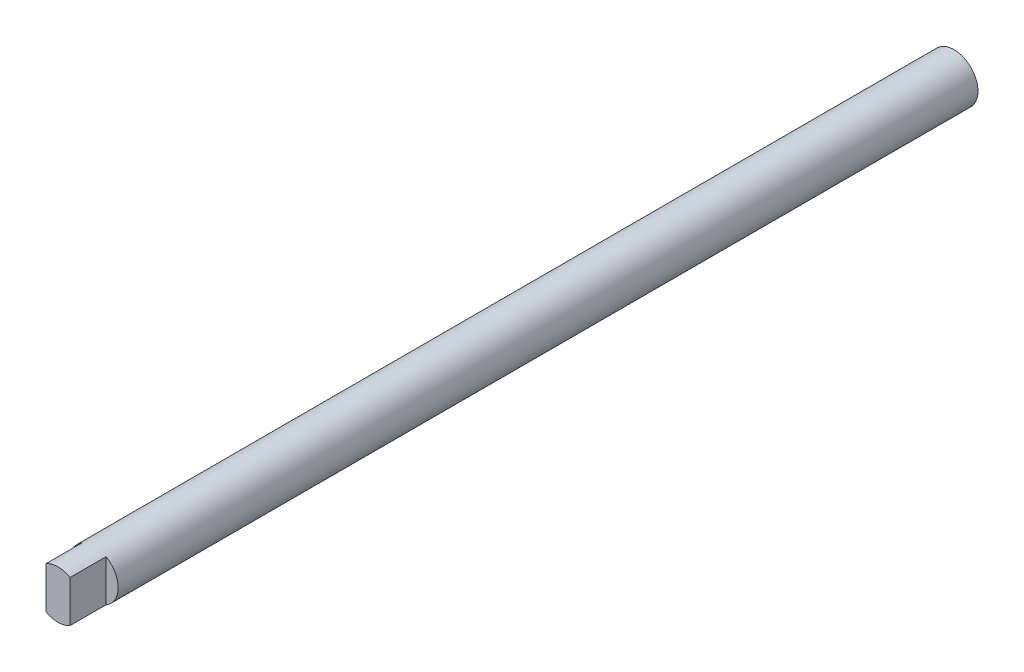
from build123d import *

# Parameters (mm, degrees)
SKETCH_1_R               = 4
EXTRUDE_1_DEPTH          = 74.5
CUT_EXTRUDE_1_DEPTH      = 75.714456432
CUT_EXTRUDE_1_DEPTH_BACK = 75.714456432
SKETCH_2_W               = 2
SKETCH_2_H               = 6


with BuildPart() as part:
    # 草图1 → 凸台-拉伸1 (new, symmetric)
    with BuildSketch(Plane.XY):
        Circle(SKETCH_1_R)
    extrude(amount=EXTRUDE_1_DEPTH, both=True)

    # 草图2 → 切除-拉伸1 (cut, two sides: drawn at the far end of the back side and taken through both)
    with BuildSketch(Plane(origin=(0, 0, 0), x_dir=(1, 0, 0), z_dir=(0, 1, 0)).offset(-CUT_EXTRUDE_1_DEPTH_BACK)):
        with Locations((-3, -71.5)):
            Rectangle(SKETCH_2_W, SKETCH_2_H)
        with Locations((3, -71.5)):
            Rectangle(SKETCH_2_W, SKETCH_2_H)
    extrude(amount=CUT_EXTRUDE_1_DEPTH + CUT_EXTRUDE_1_DEPTH_BACK, mode=Mode.SUBTRACT)


solid = part.part
